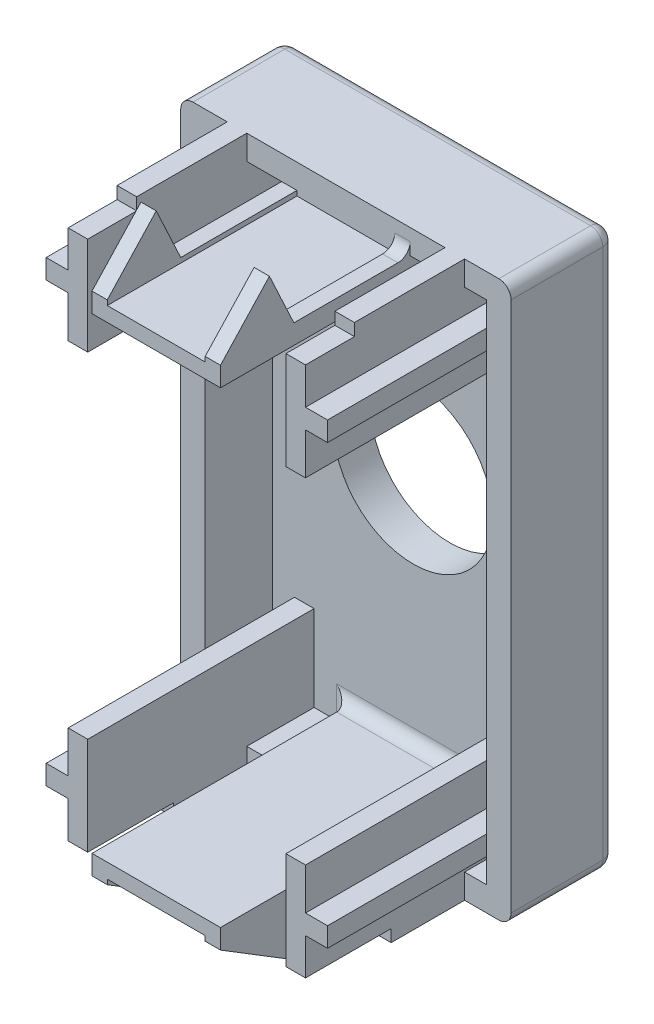
from build123d import *

# Parameters (mm, degrees)
SKETCH_1_W           = 27
SKETCH_1_H           = 45.4
SKETCH_1_R           = 6.5
EXTRUDE_1_DEPTH      = 8.5
CUT_EXTRUDE_1_DEPTH  = 21
SKETCH_3_W           = 23
SKETCH_3_H           = 41.4
CUT_EXTRUDE_2_DEPTH  = 5.5
EXTRUDE_2_DEPTH      = 18.5
EXTRUDE_3_DEPTH      = 5.25
EXTRUDE_3_DEPTH_BACK = 5.25
SKETCH_7_W           = 4
SKETCH_7_H           = 1
SKETCH_7_W_2         = 7
CUT_EXTRUDE_3_DEPTH  = 3
SKETCH_8_W           = 7
SKETCH_8_H           = 1
SKETCH_8_W_2         = 4
CUT_EXTRUDE_4_DEPTH  = 3
CUT_EXTRUDE_START    = -15.5
SKETCH_9_W           = 8
SKETCH_9_H           = 13.007388574
CUT_EXTRUDE_5_DEPTH  = 15.5
FILLET_1_R           = 1
FILLET_3_R           = 1
SKETCH_10_W          = 22.881985058
SKETCH_10_H          = 38.494603021
SKETCH_10_R          = 6.5
EXTRUDE_4_DEPTH      = 3


with BuildPart() as part:
    # Эскиз1 → Бобышка-Вытянуть1 (new body)
    with BuildSketch(Plane.XY):
        with Locations((13.5, 22.7)):
            Rectangle(SKETCH_1_W, SKETCH_1_H)
        with Locations((13.5, 22.7)):
            Circle(SKETCH_1_R, mode=Mode.SUBTRACT)
    extrude(amount=EXTRUDE_1_DEPTH)

    # Эскиз2 → Вырез-Вытянуть1 (cut)
    with BuildSketch(Plane(origin=(3, 0, 0), x_dir=(0, 0, -1), z_dir=(1, 0, 0))):
        with BuildLine():
            Line((0, 40.4), (0, 5))
            ThreePointArc((0, 5), (-1, 22.7), (0, 40.4))
        make_face()
    extrude(amount=CUT_EXTRUDE_1_DEPTH, mode=Mode.SUBTRACT)

    # Эскиз3 → Вырез-Вытянуть2 (cut)
    with BuildSketch(Plane.XY.offset(8.5)):
        with Locations((13.5, 22.7)):
            Rectangle(SKETCH_3_W, SKETCH_3_H)
    extrude(amount=-CUT_EXTRUDE_2_DEPTH, mode=Mode.SUBTRACT)

    # Эскиз4 → Бобышка-Вытянуть2 (add)
    with BuildSketch(Plane.XY.offset(3)):
        Polygon((3.8, 45.4), (3.8, 41.4), (2, 41.4), (2, 39.8), (3.8, 39.8), (3.8, 36.4), (5.4, 36.4), (5.4, 45.4), align=None)
        Polygon((21.6, 45.4), (23.2, 45.4), (23.2, 41.4), (25, 41.4), (25, 39.8), (23.2, 39.8), (23.2, 36.4), (21.6, 36.4), align=None)
        Polygon((23.2, 0), (23.2, 4), (25, 4), (25, 5.6), (23.2, 5.6), (23.2, 9), (21.6, 9), (21.6, 0), align=None)
        Polygon((5.4, 0), (3.8, 0), (3.8, 4), (2, 4), (2, 5.6), (3.8, 5.6), (3.8, 9), (5.4, 9), align=None)
    extrude(amount=EXTRUDE_2_DEPTH)

    # Эскиз6 → Бобышка-Вытянуть3 (add, two sides: drawn at the far end of the back side and taken through both)
    with BuildSketch(Plane.ZY.offset(-13.5).offset(-EXTRUDE_3_DEPTH_BACK)):
        Polygon((3, 2), (3, 3.6), (24, 3.6), (24, 2), (17, -2.3), (15, 2), align=None)
        Polygon((18, 43.4), (3, 43.4), (3, 41.8), (24, 41.8), (24, 43.4), (20, 47.7), align=None)
    extrude(amount=EXTRUDE_3_DEPTH + EXTRUDE_3_DEPTH_BACK)

    # Эскиз7 → Вырез-Вытянуть3 (cut)
    with BuildSketch(Plane.ZY.offset(-3.8)):
        with Locations((19.5, 44.9)):
            Rectangle(SKETCH_7_W, SKETCH_7_H)
        with Locations((18, 0.5)):
            Rectangle(SKETCH_7_W_2, SKETCH_7_H)
    extrude(amount=-CUT_EXTRUDE_3_DEPTH, mode=Mode.SUBTRACT)

    # Эскиз8 → Вырез-Вытянуть4 (cut)
    with BuildSketch(Plane(origin=(23.2, 0, 0), x_dir=(0, 0, -1), z_dir=(1, 0, 0))):
        with Locations((-18, 0.5)):
            Rectangle(SKETCH_8_W, SKETCH_8_H)
        with Locations((-19.5, 44.9)):
            Rectangle(SKETCH_8_W_2, SKETCH_8_H)
    extrude(amount=-CUT_EXTRUDE_4_DEPTH, mode=Mode.SUBTRACT)

    # Эскиз9 → Вырез-Вытянуть5 (cut)
    with BuildSketch(Plane.XY.offset(24).offset(CUT_EXTRUDE_START)):
        with Locations((13.5, -4.103694287)):
            Rectangle(SKETCH_9_W, SKETCH_9_H)
        with Locations((13.5, 49.503694287)):
            Rectangle(SKETCH_9_W, SKETCH_9_H)
    extrude(amount=CUT_EXTRUDE_5_DEPTH, mode=Mode.SUBTRACT)

    # Скругление1
    fillet_1_edges = [part.edges().sort_by_distance(p)[0] for p in [
        (13.5, 45.4, 0),
        (27, 22.7, 0),
        (13.5, 0, 0),
        (0, 22.7, 0),
        (0, 45.4, 4.25),
        (27, 45.4, 4.25),
        (27, 0, 4.25),
        (0, 0, 4.25),
    ]]
    fillet(fillet_1_edges, radius=FILLET_1_R)

    # Скругление3
    fillet_3_edges = [part.edges().sort_by_distance(p)[0] for p in [
        (8.875, 2, 8.5),
        (18.75, 2.8, 3),
        (13.5, 3.6, 3),
        (8.25, 2.8, 3),
        (18.125, 43.4, 8.5),
        (13.5, 41.8, 3),
        (18.75, 42.6, 3),
        (8.25, 42.6, 3),
    ]]
    fillet(fillet_3_edges, radius=FILLET_3_R)

    # Эскиз10 → Бобышка-Вытянуть4 (add)
    with BuildSketch(Plane(origin=(0, 0, 0), x_dir=(-1, 0, 0), z_dir=(0, 0, -1))):
        with Locations((-13.488807008, 22.65959588)):
            Rectangle(SKETCH_10_W, SKETCH_10_H)
        with Locations((-13.5, 22.7)):
            Circle(SKETCH_10_R, mode=Mode.SUBTRACT)
    extrude(amount=-EXTRUDE_4_DEPTH)


solid = part.part
